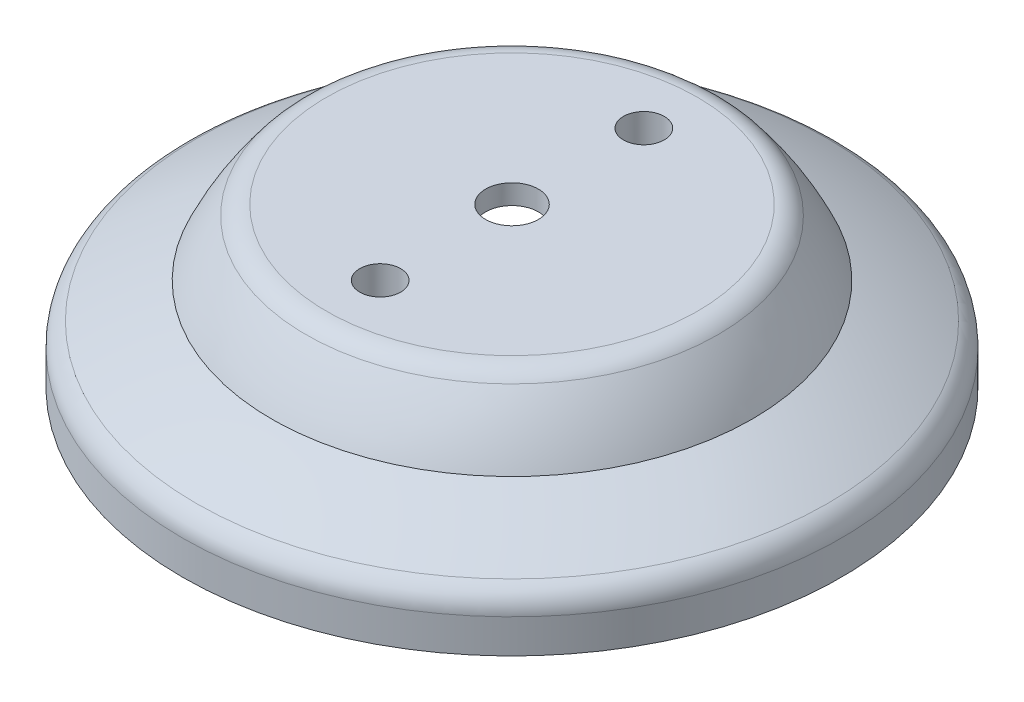
from build123d import *

# Parameters (mm, degrees)
CROQUIS5_R              = 2
CORTAR_EXTRUIR1_DEPTH   = 6
CROQUIS6_R              = 23.5
CORTAR_EXTRUIR2_DEPTH   = 0.5
CROQUIS7_R              = 3.05
CROQUIS7_R_2            = 1.55
SALIENTE_EXTRUIR1_DEPTH = 9.5
CORTAR_EXTRUIR3_START   = -5.5
CROQUIS8_R              = 1.55
CORTAR_EXTRUIR3_DEPTH   = 5.5
REDONDEO1_R             = 2
REDONDEO2_R             = 2
CROQUIS9_R              = 23.5
CORTAR_EXTRUIR4_DEPTH   = 1


with BuildPart() as part:
    # Croquis3 → Revolución1 (revolve)
    with BuildSketch(Plane.XY):
        with BuildLine():
            Line((25, 0), (25, 3.742571384))
            ThreePointArc((25, 3.742571384), (21.675655898, 5.498663982), (18.228756555, 7))
            ThreePointArc((18.228756555, 7), (16.801415582, 9.620779584), (15, 12))
            Line((15, 12), (0, 12))
            Line((0, 12), (0, 0))
            Line((0, 0), (25, 0))
        make_face()
    revolve(axis=Axis((0, 0, 0), (0, 1, 0)))

    # Croquis4 → Cortar-Revolución1 (revolve, cut)
    with BuildSketch(Plane.XY):
        with BuildLine():
            Line((0, 1.5), (0, 10.5))
            Line((0, 10.5), (14.30686093, 10.5))
            ThreePointArc((14.30686093, 10.5), (15.877398251, 8.266411941), (17.102065618, 5.825983099))
            ThreePointArc((17.102065618, 5.825983099), (20.35484662, 4.463230038), (23.5, 2.867708066))
            Line((23.5, 2.867708066), (23.5, 1.5))
            Line((23.5, 1.5), (0, 1.5))
        make_face()
    revolve(axis=Axis((0, 10.5, 0), (0, 1, 0)), mode=Mode.SUBTRACT)

    # Croquis5 → Cortar-Extruir1 (cut)
    with BuildSketch(Plane(origin=(0, 12, 0), x_dir=(1, 0, 0), z_dir=(0, 1, 0))):
        with Locations(Location((0, 0, 0), (0, 0, 270))):
            Circle(CROQUIS5_R)
    extrude(amount=-CORTAR_EXTRUIR1_DEPTH, mode=Mode.SUBTRACT)

    # Croquis6 → Cortar-Extruir2 (cut)
    with BuildSketch(Plane.XZ):
        Circle(CROQUIS6_R)
    extrude(amount=-CORTAR_EXTRUIR2_DEPTH, mode=Mode.SUBTRACT)

    # Croquis7 → Saliente-Extruir1 (add)
    # profile 1 of 2: a face of its own
    with BuildSketch(Plane.XZ.offset(-10.5)):
        with Locations(Location((0, 10, 0), (0, 0, 180))):
            Circle(CROQUIS7_R)
        with Locations((0, 10)):
            Circle(CROQUIS7_R_2, mode=Mode.SUBTRACT)
    # profile 2 of 2: a face of its own
    with BuildSketch(Plane.XZ.offset(-10.5)):
        with Locations(Location((0, -10, 0), (0, 0, 180))):
            Circle(CROQUIS7_R)
        with Locations(Location((0, -10, 0), (0, 0, 90))):
            Circle(CROQUIS7_R_2, mode=Mode.SUBTRACT)
    extrude(amount=SALIENTE_EXTRUIR1_DEPTH)

    # Croquis8 → Cortar-Extruir3 (cut)
    with BuildSketch(Plane.XZ.offset(-10.5).offset(CORTAR_EXTRUIR3_START)):
        with Locations((0, -10)):
            Circle(CROQUIS8_R)
        with Locations((0, 10)):
            Circle(CROQUIS8_R)
    extrude(amount=CORTAR_EXTRUIR3_DEPTH, mode=Mode.SUBTRACT)

    # Redondeo1
    redondeo1_edges = [part.edges().sort_by_distance(p)[0] for p in [
        (-15, 12, 0),
    ]]
    fillet(redondeo1_edges, radius=REDONDEO1_R)

    # Redondeo2
    redondeo2_edges = [part.edges().sort_by_distance(p)[0] for p in [
        (-25, 3.742571384, 0),
    ]]
    fillet(redondeo2_edges, radius=REDONDEO2_R)

    # Croquis9 → Cortar-Extruir4 (cut)
    with BuildSketch(Plane.XZ.offset(-0.5)):
        Circle(CROQUIS9_R)
    extrude(amount=-CORTAR_EXTRUIR4_DEPTH, mode=Mode.SUBTRACT)


solid = part.part
